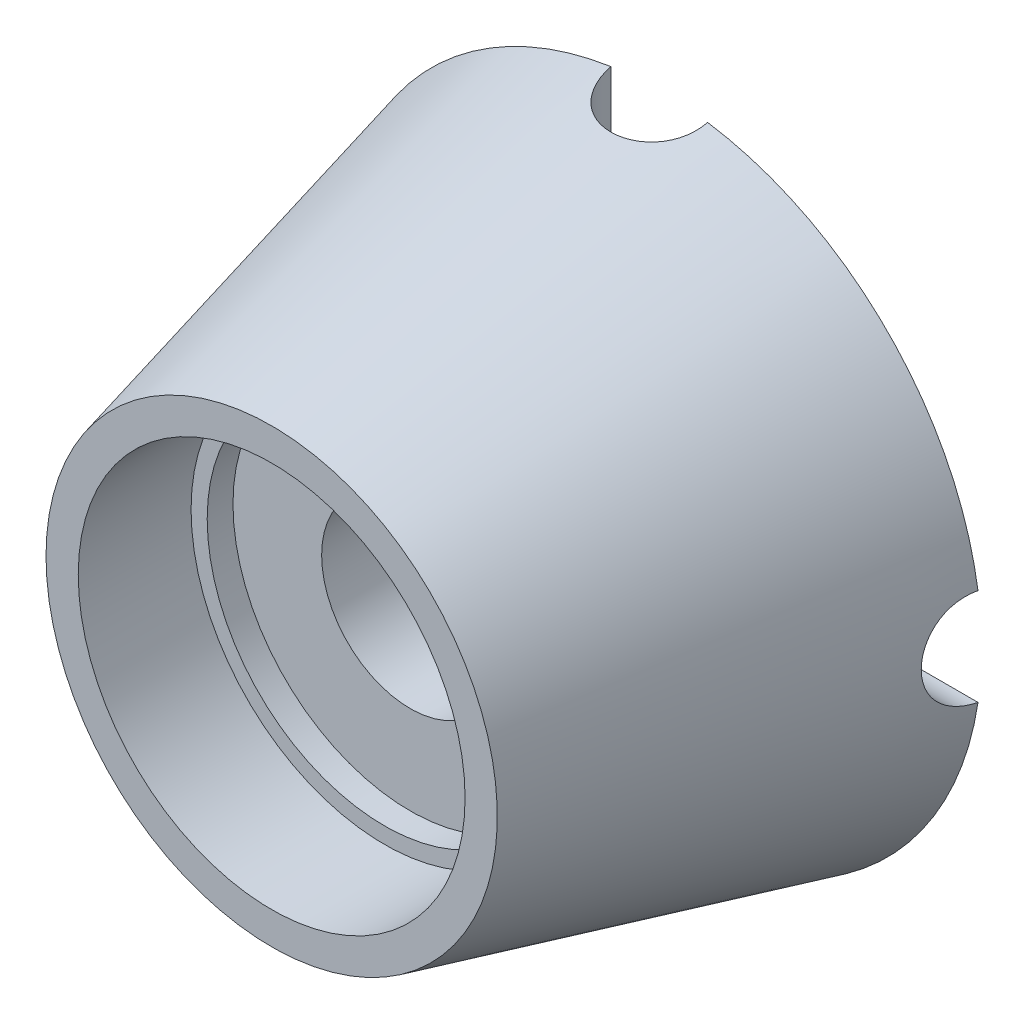
from build123d import *

# Parameters (mm, degrees)
CUT_EXTRUDE3_DEPTH      = 186.625026901
CUT_EXTRUDE3_DEPTH_BACK = 186.625026901
SKETCH5_R               = 15
CUT_EXTRUDE4_DEPTH      = 186.017973926
CUT_EXTRUDE4_DEPTH_BACK = 186.017973926
SKETCH7_R               = 15


with BuildPart() as part:
    # Sketch2 → Revolve2 (revolve)
    with BuildSketch(Plane(origin=(0, 0, 0), x_dir=(1, 0, 0), z_dir=(0, 1, 0)), mode=Mode.PRIVATE) as revolve2_sk:
        Polygon((76.5673553, 108.935679163), (65.10595835, 63), (27.5, 63), (27.5, 43), (55, 43), (55, 35), (60, 35), (60, 0), (70, 0), (96.705505264, 107.031937471), (100, 120.235812519), (79.386848042, 120.235812519), align=None)
    revolve(revolve2_sk.sketch.rotate(Axis((0, 0, -120), (0, 0, 1)), 180), axis=Axis((0, 0, -120), (0, 0, 1)))

    # Sketch5 → Cut-Extrude3 (cut, two sides: drawn at the far end of the back side and taken through both)
    with BuildSketch(Plane(origin=(0, 0, 0), x_dir=(0, 0, -1), z_dir=(1, 0, 0)).offset(-CUT_EXTRUDE3_DEPTH_BACK)):
        with Locations((120.235812519, 0)):
            Circle(SKETCH5_R)
    extrude(amount=CUT_EXTRUDE3_DEPTH + CUT_EXTRUDE3_DEPTH_BACK, mode=Mode.SUBTRACT)

    # Sketch7 → Cut-Extrude4 (cut, two sides: drawn at the far end of the back side and taken through both)
    with BuildSketch(Plane(origin=(0, 0, 0), x_dir=(1, 0, 0), z_dir=(0, 1, 0)).offset(-CUT_EXTRUDE4_DEPTH_BACK)):
        with Locations((0, 120.235812519)):
            Circle(SKETCH7_R)
    extrude(amount=CUT_EXTRUDE4_DEPTH + CUT_EXTRUDE4_DEPTH_BACK, mode=Mode.SUBTRACT)


solid = part.part
